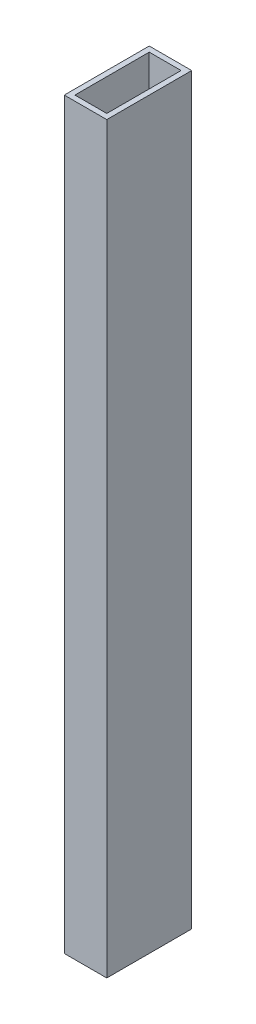
from build123d import *

# Parameters (mm, degrees)
SKETCH1_W           = 25.4
SKETCH1_H           = 50.8
SKETCH1_W_2         = 19.05
SKETCH1_H_2         = 44.45
BOSS_EXTRUDE1_DEPTH = 444.5


with BuildPart() as part:
    # Sketch1 → Boss-Extrude1 (new body)
    with BuildSketch(Plane(origin=(0, 0, 0), x_dir=(1, 0, 0), z_dir=(0, 1, 0))):
        with Locations((12.7, 25.4)):
            Rectangle(SKETCH1_W, SKETCH1_H)
        with Locations((12.7, 25.4)):
            Rectangle(SKETCH1_W_2, SKETCH1_H_2, mode=Mode.SUBTRACT)
    extrude(amount=BOSS_EXTRUDE1_DEPTH)


solid = part.part
